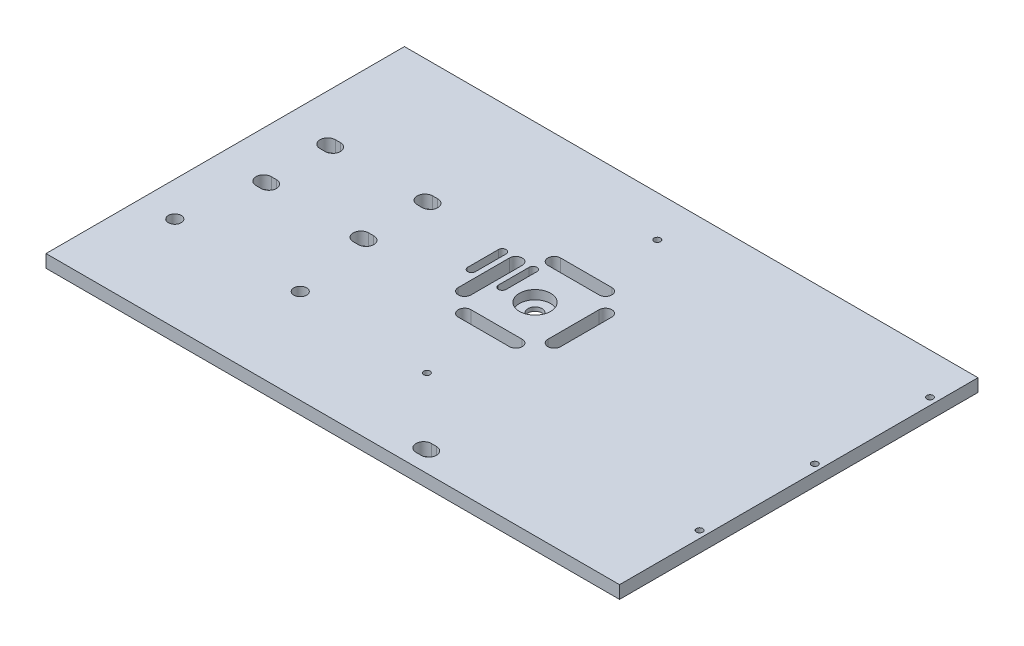
from build123d import *

# Parameters (mm, degrees)
SKETCH1_W                               = 224
SKETCH1_H                               = 122
BOSS_EXTRUDE1_DEPTH                     = 5
CUT_EXTRUDE1_DEPTH                      = 5
CIRPATTERN1_COUNT                       = 4
SKETCH3_R                               = 2.75
CUT_EXTRUDE5_DEPTH                      = 5
CBORE_FOR_M5_HEX_HEAD_BOLT1_D           = 5.5
CBORE_FOR_M5_HEX_HEAD_BOLT1_DEPTH       = 12.4
CBORE_FOR_M5_HEX_HEAD_BOLT1_CBORE_D     = 12.238
CBORE_FOR_M5_HEX_HEAD_BOLT1_CBORE_DEPTH = 3.5
CBORE_FOR_M5_HEX_HEAD_BOLT1_TIP         = 1.652366702
F_2_5MM_DOWEL_HOLE1_AT_2_COUNT          = 2
F_2_5MM_DOWEL_HOLE1_AT_2_PITCH          = 45
F_2_5MM_DOWEL_HOLE1_AT_3_COUNT          = 2
F_2_5MM_DOWEL_HOLE1_AT_3_PITCH          = 90
LPATTERN1_COUNT                         = 2
LPATTERN1_PITCH                         = 106.5
BOSS_EXTRUDE3_START                     = -1.5
SKETCH11_R                              = 4
SKETCH11_R_2                            = 2.75
BOSS_EXTRUDE3_DEPTH                     = 1.5
CUT_EXTRUDE6_DEPTH                      = 10
LPATTERN2_COUNT                         = 2
LPATTERN2_PITCH                         = 25
SKETCH13_R                              = 2.5
CUT_EXTRUDE7_DEPTH                      = 10
SKETCH15_W                              = 224
SKETCH15_H                              = 5
BOSS_EXTRUDE4_DEPTH                     = 18
CUT_EXTRUDE8_DEPTH                      = 5
CUT_EXTRUDE9_DEPTH                      = 10


with BuildPart() as part:
    # Sketch1 → Boss-Extrude1 (new body)
    with BuildSketch(Plane(origin=(0, 0, 0), x_dir=(1, 0, 0), z_dir=(0, 1, 0))):
        Rectangle(SKETCH1_W, SKETCH1_H)
    extrude(amount=BOSS_EXTRUDE1_DEPTH)

    # Sketch2 → Cut-Extrude1 (cut)
    with BuildSketch(Plane.XZ):
        with BuildLine():
            Line((-15, 10), (-15, -10))
            ThreePointArc((-15, -10), (-17.5, -12.5), (-20, -10))
            Line((-20, -10), (-20, 10))
            ThreePointArc((-20, 10), (-17.5, 12.5), (-15, 10))
        make_face()
    cut_extrude1 = extrude(amount=-CUT_EXTRUDE1_DEPTH, mode=Mode.SUBTRACT)

    # CirPattern1: Cut-Extrude1 ×4 about axis
    cirpattern1_axis = Axis((0, 0, 0), (0, 1, 0))
    for i in range(1, CIRPATTERN1_COUNT):
        add(cut_extrude1.rotate(cirpattern1_axis, i * 360 / CIRPATTERN1_COUNT), mode=Mode.SUBTRACT)

    # Sketch3 → Cut-Extrude5 (cut)
    with BuildSketch(Plane(origin=(0, 0, 0), x_dir=(1, 0, 0), z_dir=(0, 1, 0))):
        with Locations(Location((0, 0, 0), (0, 0, 270))):
            Circle(SKETCH3_R)
    extrude(amount=CUT_EXTRUDE5_DEPTH, mode=Mode.SUBTRACT)

    # CBORE for M5 Hex Head Bolt1
    with Locations(Plane(origin=(0, 5, 0), x_dir=(1, 0, 0), z_dir=(0, 1, 0))):
        with Locations((0, 0)):
            CounterBoreHole(CBORE_FOR_M5_HEX_HEAD_BOLT1_D / 2, CBORE_FOR_M5_HEX_HEAD_BOLT1_CBORE_D / 2, CBORE_FOR_M5_HEX_HEAD_BOLT1_CBORE_DEPTH, depth=CBORE_FOR_M5_HEX_HEAD_BOLT1_DEPTH)
            with Locations((0, 0, -(CBORE_FOR_M5_HEX_HEAD_BOLT1_DEPTH + CBORE_FOR_M5_HEX_HEAD_BOLT1_TIP / 2))):  # 118° drill point
                Cone(0, CBORE_FOR_M5_HEX_HEAD_BOLT1_D / 2, CBORE_FOR_M5_HEX_HEAD_BOLT1_TIP, mode=Mode.SUBTRACT)

    # Sketch10 → Ø2.5mm Dowel Hole1 (revolve, cut)
    with BuildSketch(Plane(origin=(109.25, 5, 45), x_dir=(0, 0, 1), z_dir=(1, 0, 0))):
        Polygon((0, 0), (0, 13.151075774), (1.25, 12.4), (1.25, 0), align=None)
    f_2_5mm_dowel_hole1 = revolve(axis=Axis((109.25, 11.35, 45), (0, -1, 0)), mode=Mode.SUBTRACT)

    # Ø2.5mm Dowel Hole1 at 2: Ø2.5mm Dowel Hole1 ×2
    with Locations(*[(0, 0, -i * F_2_5MM_DOWEL_HOLE1_AT_2_PITCH) for i in range(1, F_2_5MM_DOWEL_HOLE1_AT_2_COUNT)]):
        add(f_2_5mm_dowel_hole1, mode=Mode.SUBTRACT)

    # Ø2.5mm Dowel Hole1 at 3: Ø2.5mm Dowel Hole1 ×2
    with Locations(*[(0, 0, -i * F_2_5MM_DOWEL_HOLE1_AT_3_PITCH) for i in range(1, F_2_5MM_DOWEL_HOLE1_AT_3_COUNT)]):
        add(f_2_5mm_dowel_hole1, mode=Mode.SUBTRACT)

    # LPattern1: Ø2.5mm Dowel Hole1 ×2
    with Locations(*[(-i * LPATTERN1_PITCH, 0, 0) for i in range(1, LPATTERN1_COUNT)]):
        add(f_2_5mm_dowel_hole1, mode=Mode.SUBTRACT)

    # LPattern1 copy 1 sketch → LPattern1 copy 1 (revolve, cut)
    with BuildSketch(Plane(origin=(2.75, 5, 0), x_dir=(0, 0, 1), z_dir=(1, 0, 0))):
        Polygon((0, 0), (0, 13.151075774), (1.25, 12.4), (1.25, 0), align=None)
    revolve(axis=Axis((2.75, 11.35, 0), (0, -1, 0)), mode=Mode.SUBTRACT)

    # LPattern1 copy 2 sketch → LPattern1 copy 2 (revolve, cut)
    with BuildSketch(Plane(origin=(2.75, 5, -45), x_dir=(0, 0, 1), z_dir=(1, 0, 0))):
        Polygon((0, 0), (0, 13.151075774), (1.25, 12.4), (1.25, 0), align=None)
    revolve(axis=Axis((2.75, 11.35, -45), (0, -1, 0)), mode=Mode.SUBTRACT)

    # Sketch11 → Boss-Extrude3 (add)
    with BuildSketch(Plane(origin=(0, 1.5, 0), x_dir=(1, 0, 0), z_dir=(0, 1, 0)).offset(BOSS_EXTRUDE3_START)):
        Circle(SKETCH11_R)
        with Locations(Location((0, 0, 0), (0, 0, 270))):
            Circle(SKETCH11_R_2, mode=Mode.SUBTRACT)
    extrude(amount=BOSS_EXTRUDE3_DEPTH)

    # Sketch12 → Cut-Extrude6 (cut)
    with BuildSketch(Plane(origin=(0, 5, 0), x_dir=(1, 0, 0), z_dir=(0, 1, 0))):
        with BuildLine():
            Line((-94, -15), (-92, -15))
            ThreePointArc((-92, -15), (-89, -12), (-92, -9))
            Line((-92, -9), (-94, -9))
            ThreePointArc((-94, -9), (-97, -12), (-94, -15))
        make_face()
        with BuildLine():
            Line((-56, -15), (-54, -15))
            ThreePointArc((-54, -15), (-51, -12), (-54, -9))
            Line((-54, -9), (-56, -9))
            ThreePointArc((-56, -9), (-59, -12), (-56, -15))
        make_face()
    cut_extrude6 = extrude(amount=-CUT_EXTRUDE6_DEPTH, mode=Mode.SUBTRACT)

    # LPattern2: Cut-Extrude6 ×2
    with Locations(*[(0, 0, -i * LPATTERN2_PITCH) for i in range(1, LPATTERN2_COUNT)]):
        add(cut_extrude6, mode=Mode.SUBTRACT)

    # Sketch13 → Cut-Extrude7 (cut)
    with BuildSketch(Plane(origin=(0, 5, 0), x_dir=(1, 0, 0), z_dir=(0, 1, 0))):
        with Locations(Location((-98.5, -42.2, 0), (0, 0, 270))):
            Circle(SKETCH13_R)
        with Locations(Location((-49.5, -42.2, 0), (0, 0, 270))):
            Circle(SKETCH13_R)
    extrude(amount=-CUT_EXTRUDE7_DEPTH, mode=Mode.SUBTRACT)

    # Sketch15 → Boss-Extrude4 (add)
    with BuildSketch(Plane.XY.offset(61)):
        with Locations((0, 2.5)):
            Rectangle(SKETCH15_W, SKETCH15_H)
    extrude(amount=BOSS_EXTRUDE4_DEPTH)

    # Sketch14 → Cut-Extrude8 (cut)
    with BuildSketch(Plane(origin=(0, 5, 0), x_dir=(1, 0, 0), z_dir=(0, 1, 0))):
        with BuildLine():
            Line((29.5, -68), (27.5, -68))
            ThreePointArc((27.5, -68), (24.5, -71), (27.5, -74))
            Line((27.5, -74), (29.5, -74))
            ThreePointArc((29.5, -74), (32.5, -71), (29.5, -68))
        make_face()
    extrude(amount=-CUT_EXTRUDE8_DEPTH, mode=Mode.SUBTRACT)

    # Sketch16 → Cut-Extrude9 (cut)
    with BuildSketch(Plane(origin=(0, 5, 0), x_dir=(1, 0, 0), z_dir=(0, 1, 0))):
        with BuildLine():
            Line((-13, 10.7), (-13, -1.3))
            ThreePointArc((-13, -1.3), (-11.5, -2.8), (-10, -1.3))
            Line((-10, -1.3), (-10, 10.7))
            ThreePointArc((-10, 10.7), (-11.5, 12.2), (-13, 10.7))
        make_face()
        with BuildLine():
            Line((-25, 10.7), (-25, -1.3))
            ThreePointArc((-25, -1.3), (-23.5, -2.8), (-22, -1.3))
            Line((-22, -1.3), (-22, 10.7))
            ThreePointArc((-22, 10.7), (-23.5, 12.2), (-25, 10.7))
        make_face()
    extrude(amount=-CUT_EXTRUDE9_DEPTH, mode=Mode.SUBTRACT)


solid = part.part
